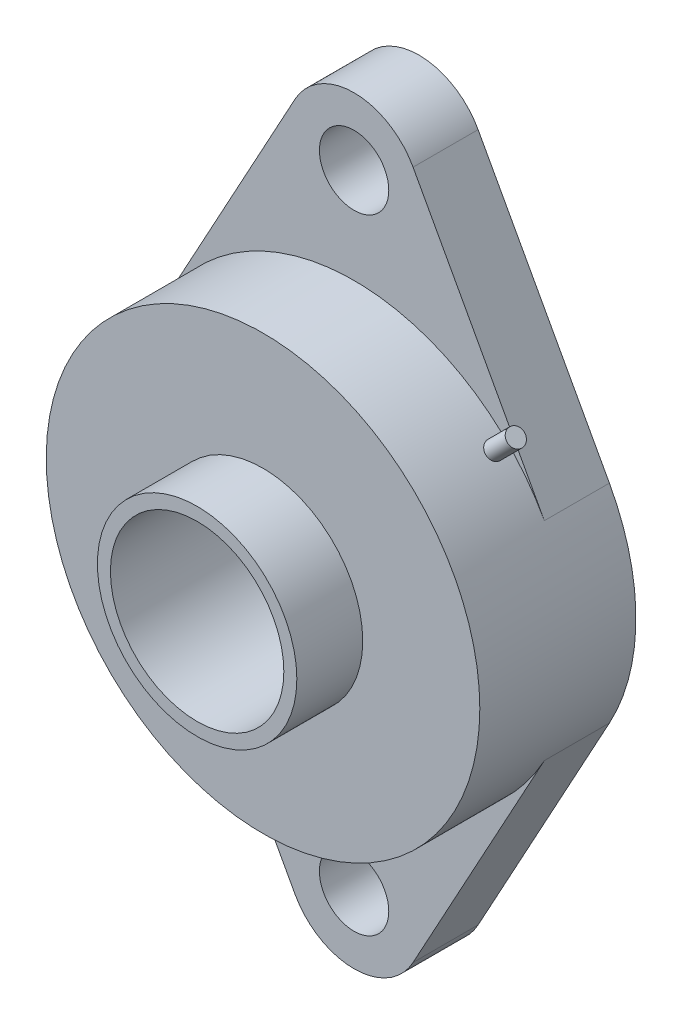
from build123d import *

# Parameters (mm, degrees)
SKETCH_1_R          = 23
SKETCH_1_R_2        = 20
EXTRUDE_1_DEPTH     = 51.2
SKETCH_2_R          = 50
SKETCH_2_R_2        = 23
EXTRUDE_2_DEPTH     = 36
EXTRUDE_3_DEPTH     = 15
SKETCH_4_R          = 8
CUT_EXTRUDE_1_DEPTH = 15
SKETCH_5_W          = 2
SKETCH_5_H          = 10
SKETCH_6_R          = 30
CUT_EXTRUDE_2_DEPTH = 2


with BuildPart() as part:
    # 草图1 → 拉伸1 (new body)
    with BuildSketch(Plane.XY):
        Circle(SKETCH_1_R)
        Circle(SKETCH_1_R_2, mode=Mode.SUBTRACT)
    extrude(amount=EXTRUDE_1_DEPTH)

    # 草图2 → 拉伸2 (add)
    with BuildSketch(Plane.XY):
        Circle(SKETCH_2_R)
        Circle(SKETCH_2_R_2, mode=Mode.SUBTRACT)
    extrude(amount=EXTRUDE_2_DEPTH)

    # 草图3 → 拉伸3 (add)
    with BuildSketch(Plane.XY):
        with BuildLine():
            Line((-43.886196735, -23.958333333), (-13.604720988, -79.427083333))
            ThreePointArc((-13.604720988, -79.427083333), (0, -87.5), (13.604720988, -79.427083333))
            Line((13.604720988, -79.427083333), (43.886196735, -23.958333333))
            ThreePointArc((43.886196735, -23.958333333), (0, -50), (-43.886196735, -23.958333333))
        make_face()
        with BuildLine():
            Line((-13.604720988, 79.427083333), (-43.886196735, 23.958333333))
            ThreePointArc((-43.886196735, 23.958333333), (0, 50), (43.886196735, 23.958333333))
            Line((43.886196735, 23.958333333), (13.604720988, 79.427083333))
            ThreePointArc((13.604720988, 79.427083333), (0, 87.5), (-13.604720988, 79.427083333))
        make_face()
    extrude(amount=EXTRUDE_3_DEPTH)

    # 草图4 → 切除-拉伸1 (cut)
    with BuildSketch(Plane.XY):
        with Locations((0, 72)):
            Circle(SKETCH_4_R)
        with Locations((0, -72)):
            Circle(SKETCH_4_R)
    extrude(amount=CUT_EXTRUDE_1_DEPTH, mode=Mode.SUBTRACT)

    # 草图5 → 旋转1 (revolve)
    with BuildSketch(Plane(origin=(0, 0, 0), x_dir=(0, 0, 1), z_dir=(-0.7071067811865488, 0.7071067811865462, 0))):
        with Locations((19, 52)):
            Rectangle(SKETCH_5_W, SKETCH_5_H)
    revolve(axis=Axis((-701.140256875, -701.140256875, 18), (0.7071067811865462, 0.7071067811865489, 0)))

    # 草图6 → 切除-拉伸2 (cut)
    with BuildSketch(Plane(origin=(0, 0, 0), x_dir=(-1, 0, 0), z_dir=(0, 0, -1))):
        Circle(SKETCH_6_R)
    extrude(amount=-CUT_EXTRUDE_2_DEPTH, mode=Mode.SUBTRACT)


solid = part.part
